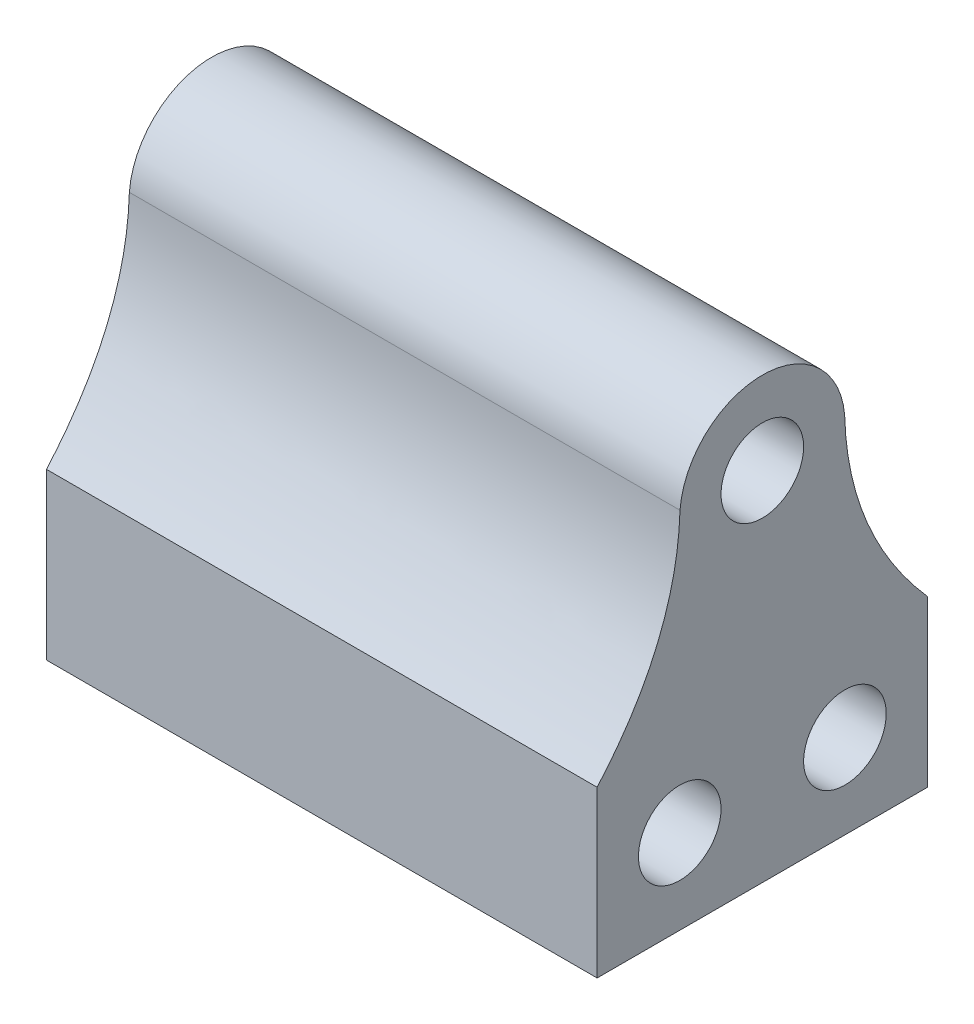
from build123d import *

# Parameters (mm, degrees)
SKETCH1_W           = 100
SKETCH1_H           = 60
BOSS_EXTRUDE1_DEPTH = 30
BOSS_EXTRUDE2_DEPTH = 100
SKETCH4_R           = 7.5
CUT_EXTRUDE1_DEPTH  = 100


with BuildPart() as part:
    # Sketch1 → Boss-Extrude1 (new body)
    with BuildSketch(Plane(origin=(0, 0, 0), x_dir=(1, 0, 0), z_dir=(0, 1, 0))):
        Rectangle(SKETCH1_W, SKETCH1_H)
    extrude(amount=BOSS_EXTRUDE1_DEPTH)

    # Sketch2 → Boss-Extrude2 (add)
    with BuildSketch(Plane(origin=(50, 0, 0), x_dir=(0, 0, -1), z_dir=(1, 0, 0))):
        with BuildLine():
            Line((-30, 30), (30, 30))
            add(Edge.make_bspline(
                [(30, 30), (15.504637598, 46.413049946), (14.954961798, 65.984799867)],
                knots=[0, 0, 0, 1, 1, 1], degree=2))
            ThreePointArc((14.954961798, 65.984799867), (0.029992259, 79.823254651), (-14.950197367, 66.044594871))
            add(Edge.make_bspline(
                [(-30, 30), (-15.530658632, 46.442080305), (-14.950197367, 66.044594871)],
                knots=[0, 0, 0, 1, 1, 1], degree=2))
        make_face()
    extrude(amount=-BOSS_EXTRUDE2_DEPTH)

    # Sketch4 → Cut-Extrude1 (cut)
    with BuildSketch(Plane(origin=(50, 0, 0), x_dir=(0, 0, -1), z_dir=(1, 0, 0))):
        with Locations((0, 64.823284635)):
            Circle(SKETCH4_R)
        with Locations((-15, 15.336875133)):
            Circle(SKETCH4_R)
        with Locations((15, 15.336875133)):
            Circle(SKETCH4_R)
    extrude(amount=-CUT_EXTRUDE1_DEPTH, mode=Mode.SUBTRACT)


solid = part.part
